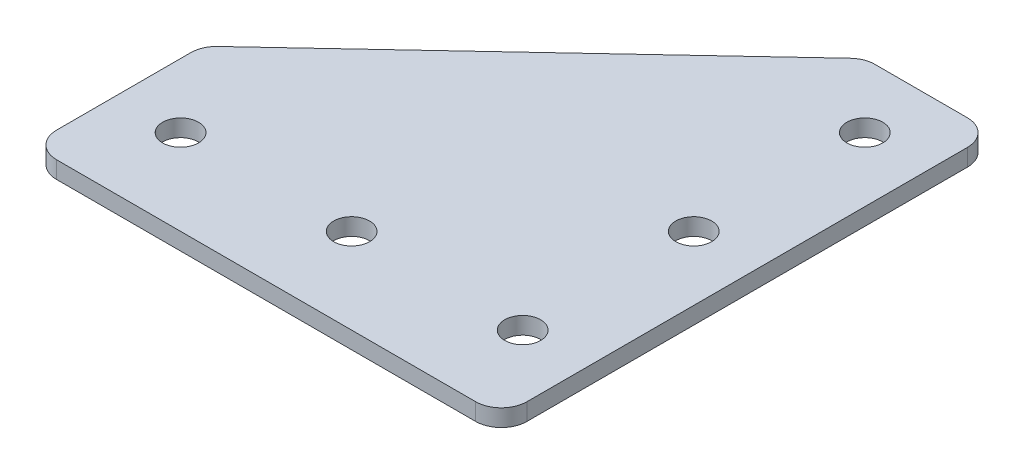
from build123d import *

# Parameters (mm, degrees)
SKETCH_1_R      = 2.1
EXTRUDE_1_DEPTH = 2
FILLET_1_R      = 3


with BuildPart() as part:
    # ｽｹｯﾁ1 → ﾎﾞｽ - 押し出し1 (new body)
    with BuildSketch(Plane(origin=(0, 0, 0), x_dir=(1, 0, 0), z_dir=(0, 1, 0))):
        Polygon((0, 0), (55, 0), (55, 57.5), (40, 57.5), (0, 20), align=None)
        with Locations(Location((7.5, 10, 0), (0, 0, 270))):
            Circle(SKETCH_1_R, mode=Mode.SUBTRACT)
        with Locations(Location((27.5, 10, 0), (0, 0, 270))):
            Circle(SKETCH_1_R, mode=Mode.SUBTRACT)
        with Locations(Location((47.5, 50, 0), (0, 0, 270))):
            Circle(SKETCH_1_R, mode=Mode.SUBTRACT)
        with Locations(Location((47.5, 30, 0), (0, 0, 270))):
            Circle(SKETCH_1_R, mode=Mode.SUBTRACT)
        with Locations(Location((47.5, 10, 0), (0, 0, 270))):
            Circle(SKETCH_1_R, mode=Mode.SUBTRACT)
    extrude(amount=EXTRUDE_1_DEPTH)

    # ﾌｨﾚｯﾄ1
    fillet_1_edges = [part.edges().sort_by_distance(p)[0] for p in [
        (0, 1, -20),
        (40, 1, -57.5),
        (55, 1, -57.5),
        (55, 1, 0),
        (0, 1, 0),
    ]]
    fillet(fillet_1_edges, radius=FILLET_1_R)


solid = part.part
